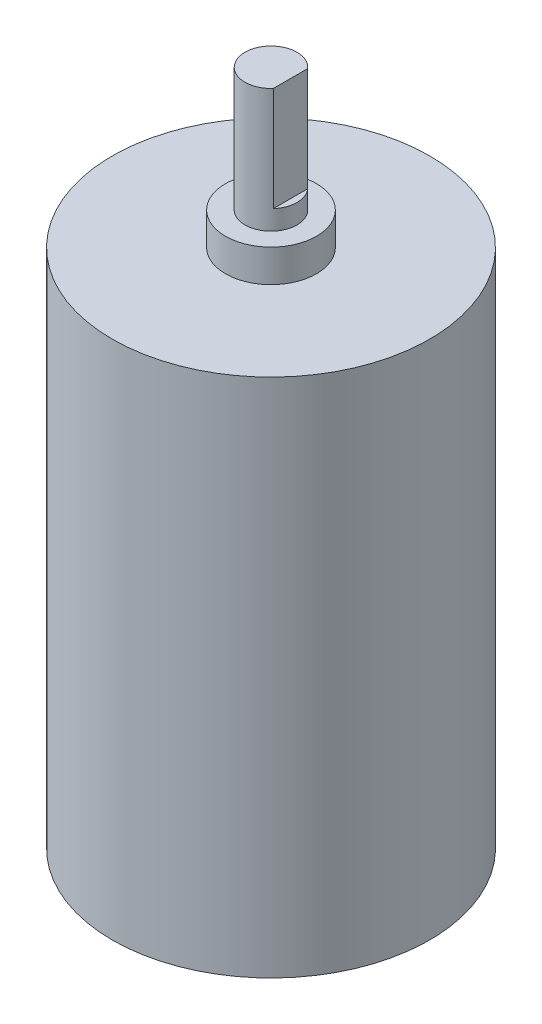
from build123d import *

# Parameters (mm, degrees)
SKETCH1_R           = 12.2
BOSS_EXTRUDE1_DEPTH = 40
SKETCH2_R           = 3.5
BOSS_EXTRUDE2_DEPTH = 2.5
SKETCH3_R           = 2
BOSS_EXTRUDE3_DEPTH = 9.5
SKETCH4_W           = 1
SKETCH4_H           = 4
CUT_EXTRUDE1_DEPTH  = 8


with BuildPart() as part:
    # Sketch1 → Boss-Extrude1 (new body)
    with BuildSketch(Plane(origin=(0, 0, 0), x_dir=(1, 0, 0), z_dir=(0, 1, 0))):
        with Locations(Location((0, 0, 0), (0, 0, 270))):
            Circle(SKETCH1_R)
    extrude(amount=BOSS_EXTRUDE1_DEPTH)

    # Sketch2 → Boss-Extrude2 (add)
    with BuildSketch(Plane(origin=(0, 40, 0), x_dir=(1, 0, 0), z_dir=(0, 1, 0))):
        with Locations(Location((0, 0, 0), (0, 0, 270))):
            Circle(SKETCH2_R)
    extrude(amount=BOSS_EXTRUDE2_DEPTH)

    # Sketch3 → Boss-Extrude3 (add)
    with BuildSketch(Plane(origin=(0, 42.5, 0), x_dir=(1, 0, 0), z_dir=(0, 1, 0))):
        with Locations(Location((0, 0, 0), (0, 0, 270))):
            Circle(SKETCH3_R)
    extrude(amount=BOSS_EXTRUDE3_DEPTH)

    # Sketch4 → Cut-Extrude1 (cut)
    with BuildSketch(Plane(origin=(0, 52, 0), x_dir=(1, 0, 0), z_dir=(0, 1, 0))):
        with Locations((2, 0)):
            Rectangle(SKETCH4_W, SKETCH4_H)
    extrude(amount=-CUT_EXTRUDE1_DEPTH, mode=Mode.SUBTRACT)


solid = part.part
